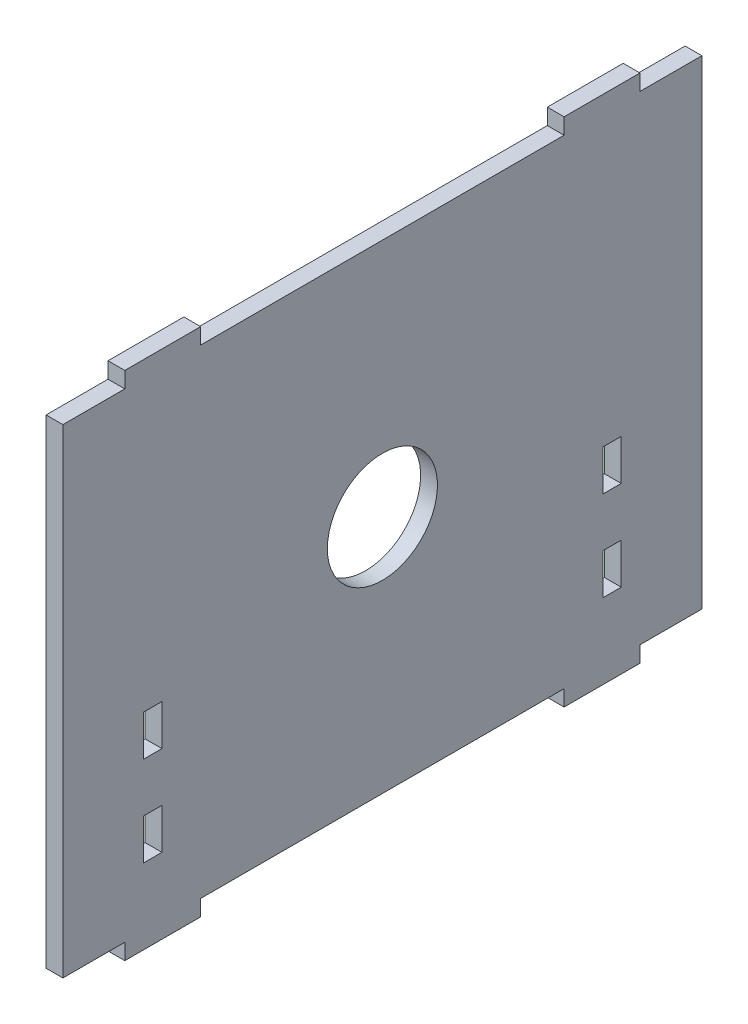
from build123d import *

# Parameters (mm, degrees)
SKETCH1_W               = 203.2
SKETCH1_H               = 152.4
BOSS_EXTRUDE2_DEPTH     = 5.334
SKETCH2_R               = 17.5
CUT_EXTRUDE1_DEPTH      = 184.239656068
SKETCH3_W               = 24.13
SKETCH3_H               = 5.08
BOSS_EXTRUDE3_DEPTH     = 5.334
SKETCH4_W               = 5.842
SKETCH4_H               = 12.954
CUT_EXTRUDE2_DEPTH      = 184.239656068
MIRROR3_COPY_1_SKETCH_W = 24.13
MIRROR3_COPY_1_SKETCH_H = 5.08
MIRROR3_COPY_1_DEPTH    = 5.334


with BuildPart() as part:
    # Sketch1 → Boss-Extrude2 (new body)
    with BuildSketch(Plane(origin=(0, 0, 0), x_dir=(0, 0, -1), z_dir=(1, 0, 0))):
        with Locations((0, 76.2)):
            Rectangle(SKETCH1_W, SKETCH1_H)
    extrude(amount=BOSS_EXTRUDE2_DEPTH)

    # Sketch2 → Cut-Extrude1 (cut, through all)
    with BuildSketch(Plane.ZY):
        with Locations((0, 76.2)):
            Circle(SKETCH2_R)
    extrude(amount=-CUT_EXTRUDE1_DEPTH, mode=Mode.SUBTRACT)

    # Sketch3 → Boss-Extrude3 (add, through all)
    with BuildSketch(Plane.ZY):
        with Locations((69.85, -2.54)):
            Rectangle(SKETCH3_W, SKETCH3_H)
    boss_extrude3 = extrude(amount=-BOSS_EXTRUDE3_DEPTH)

    # Mirror1: Boss-Extrude3 across plane
    add(boss_extrude3.mirror(Plane.XY))

    # Sketch4 → Cut-Extrude2 (cut, through all)
    with BuildSketch(Plane.ZY):
        with Locations((73.025, 53.9115)):
            Rectangle(SKETCH4_W, SKETCH4_H)
        with Locations((73.025, 25.3365)):
            Rectangle(SKETCH4_W, SKETCH4_H)
    cut_extrude2 = extrude(amount=-CUT_EXTRUDE2_DEPTH, mode=Mode.SUBTRACT)

    # Mirror2: Cut-Extrude2 across plane
    add(cut_extrude2.mirror(Plane.XY), mode=Mode.SUBTRACT)

    # Mirror3: Boss-Extrude3 across plane
    add(boss_extrude3.mirror(Plane.ZX.offset(76.2)))

    # Mirror3 copy 1 sketch → Mirror3 copy 1 (add, through all)
    with BuildSketch(Plane(origin=(0, 152.4, 0), x_dir=(0, 0, -1), z_dir=(-1, 0, 0))):
        with Locations((69.85, -2.54)):
            Rectangle(MIRROR3_COPY_1_SKETCH_W, MIRROR3_COPY_1_SKETCH_H)
    extrude(amount=-MIRROR3_COPY_1_DEPTH)


solid = part.part
